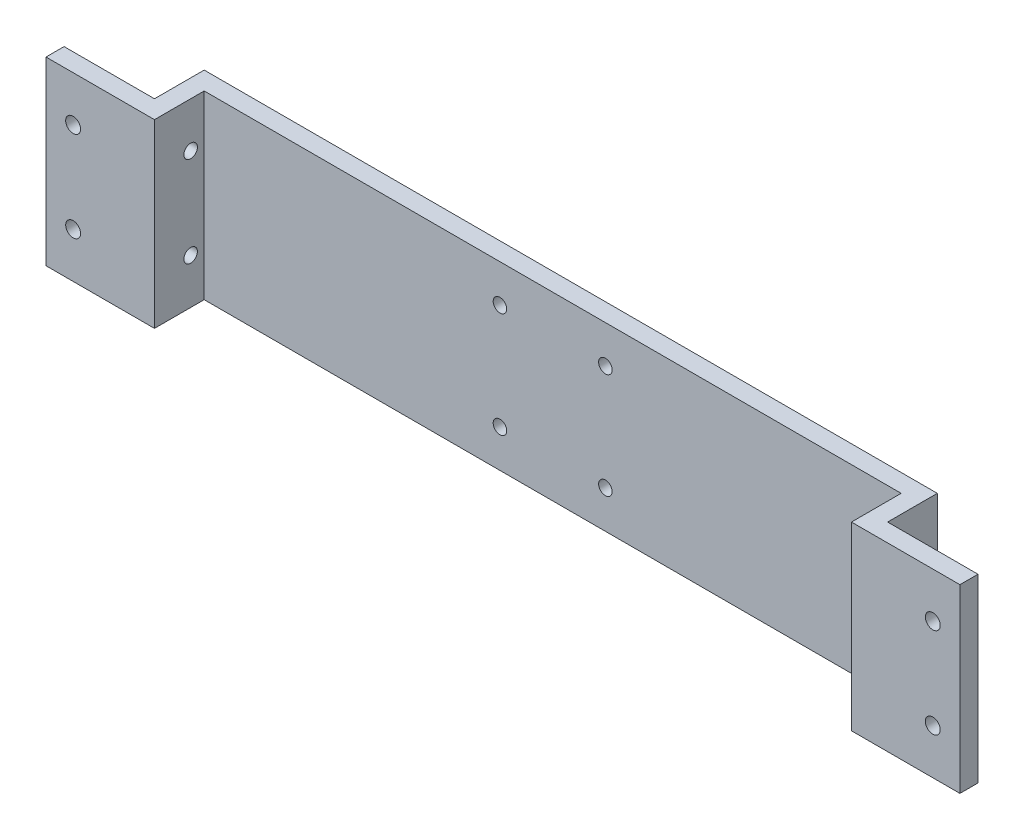
from build123d import *

# Parameters (mm, degrees)
SKETCH1_W               = 202.2
SKETCH1_H               = 40
SKETCH1_R               = 1.65
BOSS_EXTRUDE1_DEPTH     = 4
SKETCH2_W               = 162.2
SKETCH2_H               = 40
CUT_EXTRUDE1_DEPTH      = 4
BOSS_EXTRUDE3_DEPTH     = 40
CUT_EXTRUDE2_DEPTH      = 184.624181414
CUT_EXTRUDE2_DEPTH_BACK = 184.624181414
SKETCH4_R               = 1.5
CUT_EXTRUDE3_DEPTH      = 104.644633243
CUT_EXTRUDE3_DEPTH_BACK = 104.644633243
SKETCH5_R               = 1.5


with BuildPart() as part:
    # Sketch1 → Boss-Extrude1 (new body)
    with BuildSketch(Plane.XY):
        Rectangle(SKETCH1_W, SKETCH1_H)
        with Locations((-95.1, 10)):
            Circle(SKETCH1_R, mode=Mode.SUBTRACT)
        with Locations((-95.1, -10)):
            Circle(SKETCH1_R, mode=Mode.SUBTRACT)
        with Locations(Location((95.1, -10, 0), (0, 0, 180))):
            Circle(SKETCH1_R, mode=Mode.SUBTRACT)
        with Locations(Location((95.1, 10, 0), (0, 0, 180))):
            Circle(SKETCH1_R, mode=Mode.SUBTRACT)
    extrude(amount=BOSS_EXTRUDE1_DEPTH)

    # Sketch2 → Cut-Extrude1 (cut)
    with BuildSketch(Plane.XY.offset(4)):
        Rectangle(SKETCH2_W, SKETCH2_H)
    extrude(amount=-CUT_EXTRUDE1_DEPTH, mode=Mode.SUBTRACT)


with BuildPart() as cut_extrude1_piece_1:
    # of the separate pieces the step leaves, piece 1, a body of its own (cut_extrude1_pieces)
    add(part.part.solids().sort_by_distance((-101.1, 20, 0))[0])



with BuildPart() as cut_extrude1_piece_2:
    # of the separate pieces the step leaves, piece 2, a body of its own (cut_extrude1_pieces)
    add(part.part.solids().sort_by_distance((81.1, 20, 0))[0])


with BuildPart() as cut_extrude1_piece_1_1:
    add(cut_extrude1_piece_1.part)

    add(cut_extrude1_piece_2.part)  # Boss-Extrude3 merges Cut-Extrude1 piece 2
    # Sketch3 → Boss-Extrude3 (add)
    with BuildSketch(Plane.XZ.offset(20)):
        Polygon((-81.1, 4), (-77.1, 4), (-77.1, -7), (77.1, -7), (77.1, 4), (81.1, 4), (81.1, -11), (-81.1, -11), align=None)
    extrude(amount=-BOSS_EXTRUDE3_DEPTH)

    # Sketch4 → Cut-Extrude2 (cut, two sides: drawn at the far end of the back side and taken through both)
    with BuildSketch(Plane.ZY.offset(81.1).offset(-CUT_EXTRUDE2_DEPTH_BACK)):
        with Locations((-4, 10)):
            Circle(SKETCH4_R)
        with Locations((-4, -10)):
            Circle(SKETCH4_R)
    extrude(amount=CUT_EXTRUDE2_DEPTH + CUT_EXTRUDE2_DEPTH_BACK, mode=Mode.SUBTRACT)

    # Sketch5 → Cut-Extrude3 (cut, two sides: drawn at the far end of the back side and taken through both)
    with BuildSketch(Plane.XY.offset(-7).offset(-CUT_EXTRUDE3_DEPTH_BACK)):
        with Locations((-11.665, 11.665)):
            Circle(SKETCH5_R)
        with Locations((11.665, 11.665)):
            Circle(SKETCH5_R)
        with Locations((11.665, -11.665)):
            Circle(SKETCH5_R)
        with Locations((-11.665, -11.665)):
            Circle(SKETCH5_R)
    extrude(amount=CUT_EXTRUDE3_DEPTH + CUT_EXTRUDE3_DEPTH_BACK, mode=Mode.SUBTRACT)


solid = cut_extrude1_piece_1_1.part
